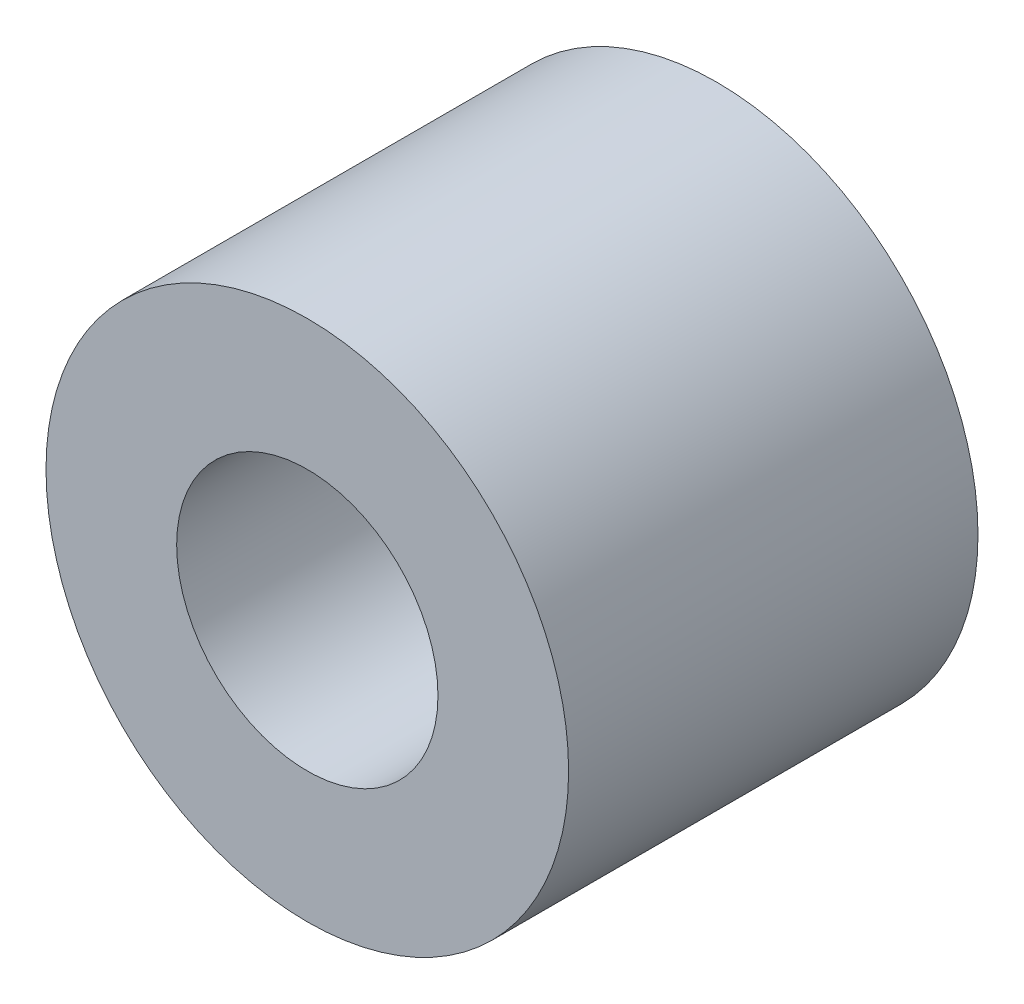
from build123d import *

# Parameters (mm, degrees)
SKETCH1_R           = 3
SKETCH1_R_2         = 1.5
BOSS_EXTRUDE1_DEPTH = 4.7


with BuildPart() as part:
    # Sketch1 → Boss-Extrude1 (new body)
    with BuildSketch(Plane.XY):
        with Locations((-46, 0)):
            Circle(SKETCH1_R)
        with Locations((-46, 0)):
            Circle(SKETCH1_R_2, mode=Mode.SUBTRACT)
    extrude(amount=-BOSS_EXTRUDE1_DEPTH)


solid = part.part
